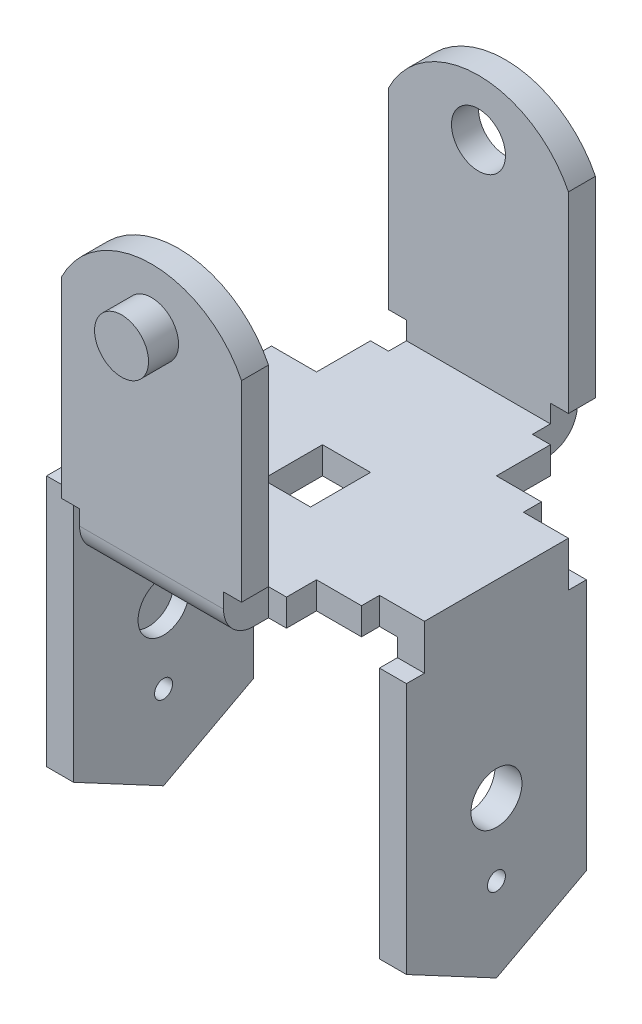
from build123d import *

# Parameters (mm, degrees)
SKETCH1_R           = 4.5
BOSS_EXTRUDE1_DEPTH = 4.5
SKETCH2_W           = 8
SKETCH2_H           = 10
BOSS_EXTRUDE2_DEPTH = 4.5
BOSS_EXTRUDE3_START = 4.5
SKETCH3_R           = 4.5
BOSS_EXTRUDE3_DEPTH = 4.5
FILLET3_R           = 5
FILLET4_R           = 5
SKETCH6_R           = 4.25
SKETCH6_R_2         = 1.5
BOSS_EXTRUDE4_DEPTH = 4.5
BOSS_EXTRUDE5_START = 4.5
SKETCH7_R           = 4.25
SKETCH7_R_2         = 1.5
BOSS_EXTRUDE5_DEPTH = 4.5
BOSS_EXTRUDE6_START = -2
SKETCH8_R           = 4.25
BOSS_EXTRUDE6_DEPTH = 2
BOSS_EXTRUDE7_START = -9.5
SKETCH9_R           = 4.5
BOSS_EXTRUDE7_DEPTH = 9.5


with BuildPart() as part:
    # Sketch1 → Boss-Extrude1 (new body)
    with BuildSketch(Plane.XY):
        with BuildLine():
            Line((-15, 17.5), (-15, -14.5))
            Line((-15, -14.5), (-12, -14.5))
            Line((-12, -14.5), (-12, -17.5))
            Line((-12, -17.5), (12, -17.5))
            Line((12, -17.5), (12, -14.5))
            Line((12, -14.5), (15, -14.5))
            Line((15, -14.5), (15, 17.5))
            ThreePointArc((15, 17.5), (0, 26.843803595), (-15, 17.5))
        make_face()
        with Locations((0, 17.5)):
            Circle(SKETCH1_R, mode=Mode.SUBTRACT)
    extrude(amount=-BOSS_EXTRUDE1_DEPTH)

    # Sketch2 → Boss-Extrude2 (add)
    with BuildSketch(Plane(origin=(0, -17.5, 0), x_dir=(1, 0, 0), z_dir=(0, 1, 0))):
        Polygon((-12, 4.5), (12, 4.5), (12, 0), (12, -3), (15, -3), (15, -12.000675804), (22.5, -12.000675804), (22.5, -15.000675804), (25.5, -15.000675804), (30, -15.000675804), (30, -39.000675804), (25.5, -39.000675804), (22.5, -39.000675804), (22.5, -42.000675804), (15, -42.000675804), (15, -47.001351609), (12, -47.001351609), (12, -50), (12, -54.5), (-12, -54.5), (-12, -50), (-12, -47), (-15, -47), (-15, -42.000675804), (-22.5, -42.000675804), (-22.5, -39.000675804), (-25.5, -39.000675804), (-30, -39.000675804), (-30, -15.000675804), (-25.5, -15.000675804), (-22.5, -15.000675804), (-22.5, -12.000675804), (-15, -12.000675804), (-15, -3), (-12, -3), (-12, 0), align=None)
        with Locations((0, -27.000675804)):
            Rectangle(SKETCH2_W, SKETCH2_H, mode=Mode.SUBTRACT)
    extrude(amount=-BOSS_EXTRUDE2_DEPTH)

    # Sketch3 → Boss-Extrude3 (add)
    with BuildSketch(Plane.XY.offset(50).offset(BOSS_EXTRUDE3_START)):
        with BuildLine():
            Line((-15, 17.5), (-15, -14.5))
            Line((-15, -14.5), (-12, -14.5))
            Line((-12, -14.5), (-12, -17.5))
            Line((-12, -17.5), (12, -17.5))
            Line((12, -17.5), (12, -14.5))
            Line((12, -14.5), (15, -14.5))
            Line((15, -14.5), (15, 17.5))
            ThreePointArc((15, 17.5), (0, 26.843803595), (-15, 17.5))
        make_face()
        with Locations((0, 17.5)):
            Circle(SKETCH3_R, mode=Mode.SUBTRACT)
    extrude(amount=-BOSS_EXTRUDE3_DEPTH)

    # Fillet3
    fillet3_edges = [part.edges().sort_by_distance(p)[0] for p in [
        (0, -22, 54.5),
    ]]
    fillet(fillet3_edges, radius=FILLET3_R)

    # Fillet4
    fillet4_edges = [part.edges().sort_by_distance(p)[0] for p in [
        (0, -22, -4.5),
    ]]
    fillet(fillet4_edges, radius=FILLET4_R)

    # Sketch6 → Boss-Extrude4 (add)
    with BuildSketch(Plane(origin=(-25.5, 0, 0), x_dir=(0, 0, -1), z_dir=(1, 0, 0))):
        Polygon((-15.000675804, -22), (-39.000675804, -22), (-39.000675804, -25), (-42.000675804, -25), (-42.000675804, -67), (-27.000675804, -75), (-12.000675804, -67), (-12.000675804, -25), (-15.000675804, -25), align=None)
        with Locations((-27.000675804, -49)):
            Circle(SKETCH6_R, mode=Mode.SUBTRACT)
        with Locations((-27.000675804, -61)):
            Circle(SKETCH6_R_2, mode=Mode.SUBTRACT)
    extrude(amount=-BOSS_EXTRUDE4_DEPTH)

    # Sketch7 → Boss-Extrude5 (add)
    with BuildSketch(Plane(origin=(25.5, 0, 0), x_dir=(0, 0, -1), z_dir=(1, 0, 0)).offset(BOSS_EXTRUDE5_START)):
        Polygon((-39.000675804, -22), (-39.000675804, -25), (-42.000675804, -25), (-42.000675804, -67), (-27.000675804, -75), (-12.000675804, -67), (-12.000675804, -25), (-15.000675804, -25), (-15.000675804, -22), align=None)
        with Locations((-27.000675804, -49)):
            Circle(SKETCH7_R, mode=Mode.SUBTRACT)
        with Locations((-27.000675804, -61)):
            Circle(SKETCH7_R_2, mode=Mode.SUBTRACT)
    extrude(amount=-BOSS_EXTRUDE5_DEPTH)

    # Sketch8 → Boss-Extrude6 (add)
    with BuildSketch(Plane.ZY.offset(30).offset(BOSS_EXTRUDE6_START)):
        with Locations(Location((27.000675804, -49, 0), (0, 0, 180))):
            Circle(SKETCH8_R)
    extrude(amount=BOSS_EXTRUDE6_DEPTH)

    # Sketch9 → Boss-Extrude7 (add)
    with BuildSketch(Plane(origin=(0, 0, 50), x_dir=(-1, 0, 0), z_dir=(0, 0, -1)).offset(BOSS_EXTRUDE7_START)):
        with Locations(Location((0, 17.5, 0), (0, 0, 180))):
            Circle(SKETCH9_R)
    extrude(amount=BOSS_EXTRUDE7_DEPTH)


solid = part.part
